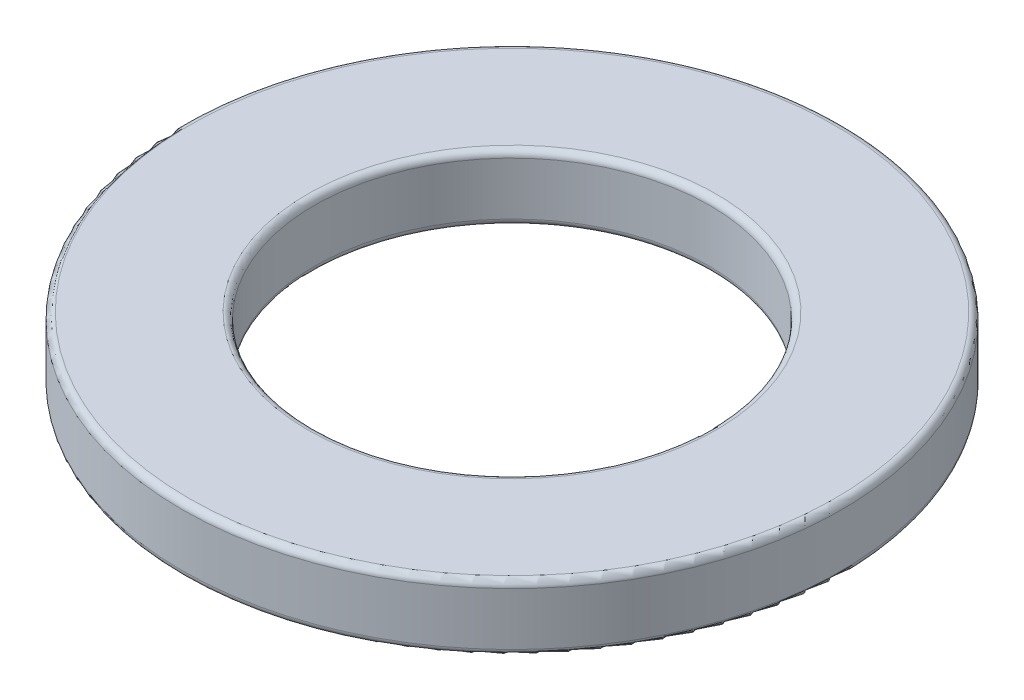
from build123d import *

# Parameters (mm, degrees)
SKETCH1_R           = 12.7
SKETCH1_R_2         = 7.62
BOSS_EXTRUDE1_DEPTH = 2.54
FILLET1_R           = 0.254


with BuildPart() as part:
    # Sketch1 → Boss-Extrude1 (new body)
    with BuildSketch(Plane(origin=(0, 0, 0), x_dir=(1, 0, 0), z_dir=(0, 1, 0))):
        with Locations(Location((0, 0, 0), (0, 0, 270))):
            Circle(SKETCH1_R)
        with Locations(Location((0, 0, 0), (0, 0, 270))):
            Circle(SKETCH1_R_2, mode=Mode.SUBTRACT)
    extrude(amount=BOSS_EXTRUDE1_DEPTH)

    # Fillet1
    fillet1_edges = [part.edges().sort_by_distance(p)[0] for p in [
        (0, 0, -12.7),
        (0, 2.54, -12.7),
        (0, 0, -7.62),
        (0, 2.54, -7.62),
    ]]
    fillet(fillet1_edges, radius=FILLET1_R)


solid = part.part
